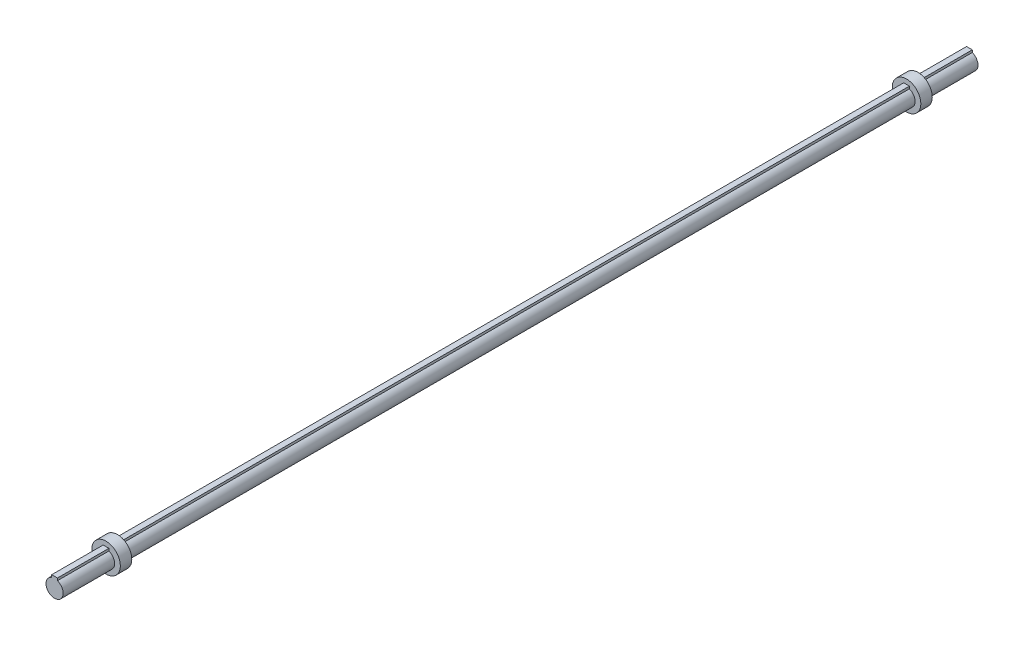
from build123d import *

# Parameters (mm, degrees)
BOSS_EXTRUDE1_DEPTH = 800
SKETCH2_R           = 25
BOSS_EXTRUDE2_DEPTH = 20


with BuildPart() as part:
    # Sketch1 → Boss-Extrude1 (new, symmetric)
    with BuildSketch(Plane.XY):
        with BuildLine():
            Line((-5, 12.492135624), (-5, 16.65))
            Line((-5, 16.65), (5, 16.65))
            Line((5, 16.65), (5, 12.492135624))
            ThreePointArc((5, 12.492135624), (0, -16.65), (-5, 12.492135624))
        make_face()
    extrude(amount=BOSS_EXTRUDE1_DEPTH, both=True)

    # Sketch2 → Boss-Extrude2 (add)
    with BuildSketch(Plane.XY.offset(710)):
        Circle(SKETCH2_R)
    boss_extrude2 = extrude(amount=-BOSS_EXTRUDE2_DEPTH)

    # Mirror1: Boss-Extrude2 across plane
    add(boss_extrude2.mirror(Plane.XY))


solid = part.part
